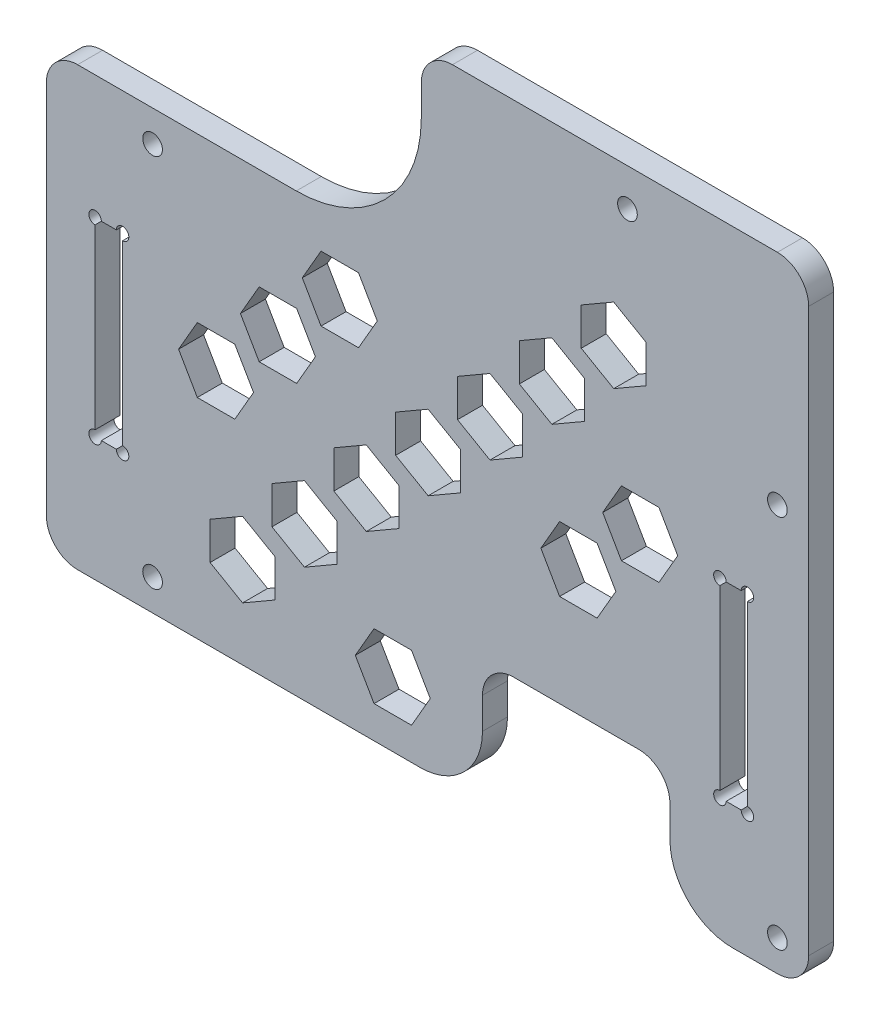
from build123d import *

# Parameters (mm, degrees)
SKETCH_1_W          = 120
SKETCH_1_H          = 70
EXTRUDE_1_DEPTH     = 4
SKETCH_2_W          = 4.4
SKETCH_2_H          = 30.4
CUT_EXTRUDE_1_DEPTH = 139.982013225
SKETCH_3_R          = 1
SKETCH_3_R_2        = 1.575
CUT_EXTRUDE_2_DEPTH = 139.982013225
EXTRUDE_2_DEPTH     = 4
SKETCH_5_R          = 1.575
SKETCH_5_W          = 30
SKETCH_5_H          = 20
CUT_EXTRUDE_3_DEPTH = 141.712472795
FILLET_1_R          = 10
FILLET_2_R          = 5
FILLET_3_R          = 20


with BuildPart() as part:
    # 草图1 → 凸台-拉伸1 (new body)
    with BuildSketch(Plane.XY):
        with Locations((60, -35)):
            Rectangle(SKETCH_1_W, SKETCH_1_H)
    extrude(amount=EXTRUDE_1_DEPTH)

    # 草图2 → 切除-拉伸1 (cut, through all)
    with BuildSketch(Plane.XY.offset(4)):
        with Locations((10, -35)):
            Rectangle(SKETCH_2_W, SKETCH_2_H)
        with Locations((110, -35)):
            Rectangle(SKETCH_2_W, SKETCH_2_H)
    extrude(amount=-CUT_EXTRUDE_1_DEPTH, mode=Mode.SUBTRACT)

    # 草图3 → 切除-拉伸2 (cut, through all)
    with BuildSketch(Plane.XY.offset(4)):
        with Locations((7.8, -19.8)):
            Circle(SKETCH_3_R)
        with Locations((12.2, -19.8)):
            Circle(SKETCH_3_R)
        with Locations((7.8, -50.2)):
            Circle(SKETCH_3_R)
        with Locations((12.2, -50.2)):
            Circle(SKETCH_3_R)
        with Locations((107.8, -19.8)):
            Circle(SKETCH_3_R)
        with Locations((107.8, -50.2)):
            Circle(SKETCH_3_R)
        with Locations((112.2, -50.2)):
            Circle(SKETCH_3_R)
        with Locations((112.2, -19.8)):
            Circle(SKETCH_3_R)
        with Locations((17, -5)):
            Circle(SKETCH_3_R_2)
        with Locations(Location((17, -65, 0), (0, 0, 180))):
            Circle(SKETCH_3_R_2)
        with Locations((117, -5)):
            Circle(SKETCH_3_R_2)
        with Locations(Location((117, -65, 0), (0, 0, 180))):
            Circle(SKETCH_3_R_2)
    extrude(amount=-CUT_EXTRUDE_2_DEPTH, mode=Mode.SUBTRACT)

    # 草图4 → 凸台-拉伸2 (add)
    with BuildSketch(Plane.XY.offset(4)):
        Polygon((60, 0), (60, 30), (122, 30), (122, -70), (120, -70), (120, 0), align=None)
    extrude(amount=-EXTRUDE_2_DEPTH)

    # 草图5 → 切除-拉伸3 (cut, through all)
    with BuildSketch(Plane.XY.offset(4)):
        with Locations((93, 24)):
            Circle(SKETCH_5_R)
        with Locations((84.8, -60)):
            Rectangle(SKETCH_5_W, SKETCH_5_H)
        Polygon((90.8, -2), (95.996152423, 1), (95.996152423, 7), (90.8, 10), (85.603847577, 7), (85.603847577, 1), align=None)
        Polygon((86.096657486, -2.899494937), (80.900505063, 0.100505063), (75.704352641, -2.899494937), (75.704352641, -8.899494937), (80.900505063, -11.899494937), (86.096657486, -8.899494937), align=None)
        Polygon((76.197162549, -12.798989873), (71.001010127, -9.798989873), (65.804857704, -12.798989873), (65.804857704, -18.798989873), (71.001010127, -21.798989873), (76.197162549, -18.798989873), align=None)
        Polygon((66.297667613, -22.69848481), (61.10151519, -19.69848481), (55.905362767, -22.69848481), (55.905362767, -28.69848481), (61.10151519, -31.69848481), (66.297667613, -28.69848481), align=None)
        Polygon((56.398172676, -32.597979746), (51.202020254, -29.597979746), (46.005867831, -32.597979746), (46.005867831, -38.597979746), (51.202020254, -41.597979746), (56.398172676, -38.597979746), align=None)
        Polygon((46.49867774, -42.497474683), (41.302525317, -39.497474683), (36.106372894, -42.497474683), (36.106372894, -48.497474683), (41.302525317, -51.497474683), (46.49867774, -48.497474683), align=None)
        Polygon((36.599182803, -52.39696962), (31.40303038, -49.39696962), (26.206877958, -52.39696962), (26.206877958, -58.39696962), (31.40303038, -61.39696962), (36.599182803, -58.39696962), align=None)
        Polygon((91.143145751, -29.941125497), (88.143145751, -35.13727792), (82.143145751, -35.13727792), (79.143145751, -29.941125497), (82.143145751, -24.744973074), (88.143145751, -24.744973074), align=None)
        Polygon((101.042640687, -20.04163056), (98.042640687, -25.237782983), (92.042640687, -25.237782983), (89.042640687, -20.04163056), (92.042640687, -14.845478138), (98.042640687, -14.845478138), align=None)
        Polygon((61.444660941, -59.639610307), (58.444660941, -64.835762729), (52.444660941, -64.835762729), (49.444660941, -59.639610307), (52.444660941, -54.443457884), (58.444660941, -54.443457884), align=None)
        Polygon((31.05988463, -21.455844123), (34.05988463, -16.2596917), (40.05988463, -16.2596917), (43.05988463, -21.455844123), (40.05988463, -26.651996545), (34.05988463, -26.651996545), align=None)
        Polygon((30.160389693, -36.551491482), (24.160389693, -36.551491482), (21.160389693, -31.355339059), (24.160389693, -26.159186637), (30.160389693, -26.159186637), (33.160389693, -31.355339059), align=None)
        Polygon((43.959379566, -16.752501609), (40.959379566, -11.556349186), (43.959379566, -6.360196763), (49.959379566, -6.360196763), (52.959379566, -11.556349186), (49.959379566, -16.752501609), align=None)
    extrude(amount=-CUT_EXTRUDE_3_DEPTH, mode=Mode.SUBTRACT)

    # 圆角1
    fillet_1_edges = [part.edges().sort_by_distance(p)[0] for p in [
        (69.8, -70, 2),
        (99.8, -70, 2),
    ]]
    fillet(fillet_1_edges, radius=FILLET_1_R)

    # 圆角2
    fillet_2_edges = [part.edges().sort_by_distance(p)[0] for p in [
        (60, 30, 2),
        (122, 30, 2),
        (122, -70, 2),
        (69.8, -50, 2),
        (99.8, -50, 2),
        (0, 0, 2),
        (0, -70, 2),
    ]]
    fillet(fillet_2_edges, radius=FILLET_2_R)

    # 圆角3
    fillet_3_edges = [part.edges().sort_by_distance(p)[0] for p in [
        (60, 0, 2),
    ]]
    fillet(fillet_3_edges, radius=FILLET_3_R)


solid = part.part
